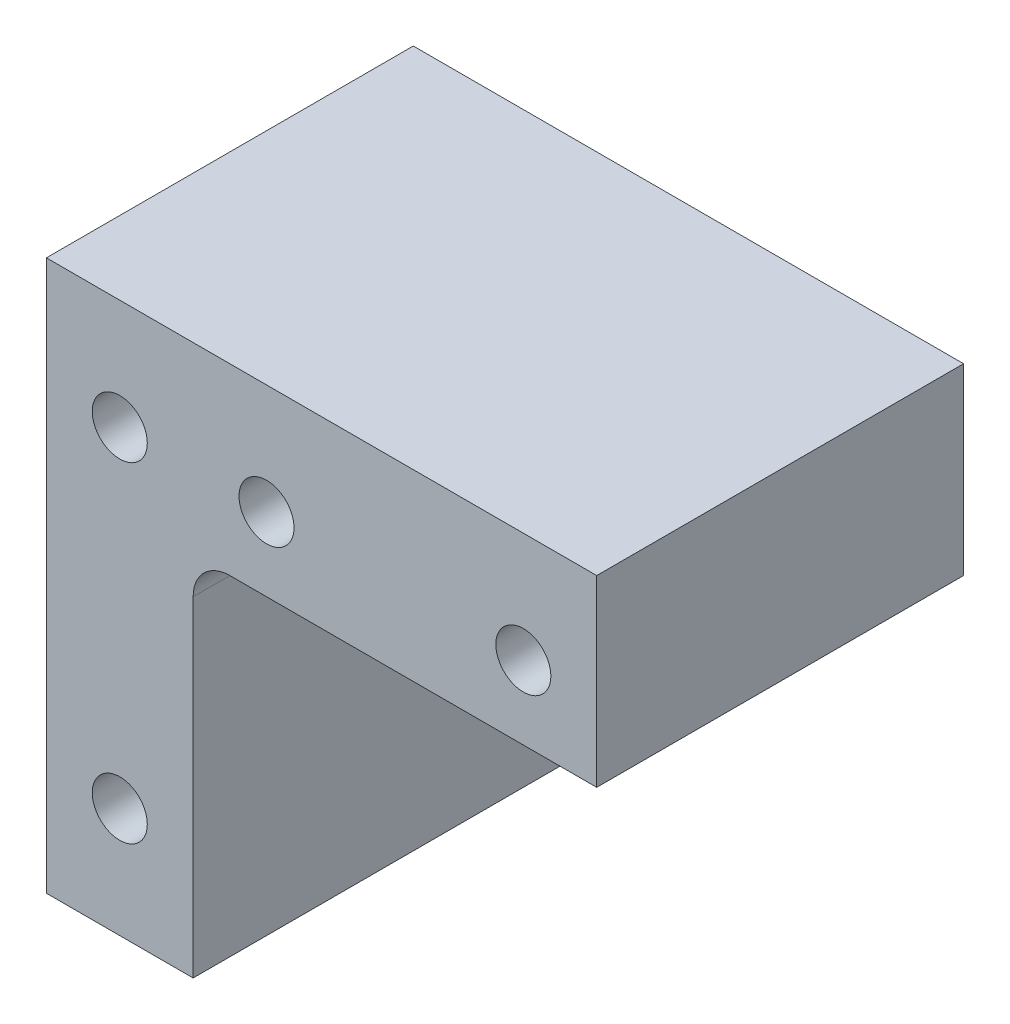
from build123d import *

# Parameters (mm, degrees)
SKETCH1_R           = 1.905
BOSS_EXTRUDE1_DEPTH = 25.4


with BuildPart() as part:
    # Sketch1 → Boss-Extrude1 (new body)
    with BuildSketch(Plane.XY):
        with BuildLine():
            Line((0, 0), (0, 38.1))
            Line((0, 38.1), (38.1, 38.1))
            Line((38.1, 38.1), (38.1, 25.4))
            Line((38.1, 25.4), (12.7, 25.4))
            ThreePointArc((12.7, 25.4), (10.903948776, 24.656051224), (10.16, 22.86))
            Line((10.16, 22.86), (10.16, 0))
            Line((10.16, 0), (0, 0))
        make_face()
        with Locations((5.08, 30.48)):
            Circle(SKETCH1_R, mode=Mode.SUBTRACT)
        with Locations((5.08, 7.62)):
            Circle(SKETCH1_R, mode=Mode.SUBTRACT)
        with Locations((15.24, 30.48)):
            Circle(SKETCH1_R, mode=Mode.SUBTRACT)
        with Locations((33.02, 30.48)):
            Circle(SKETCH1_R, mode=Mode.SUBTRACT)
    extrude(amount=BOSS_EXTRUDE1_DEPTH)


solid = part.part
